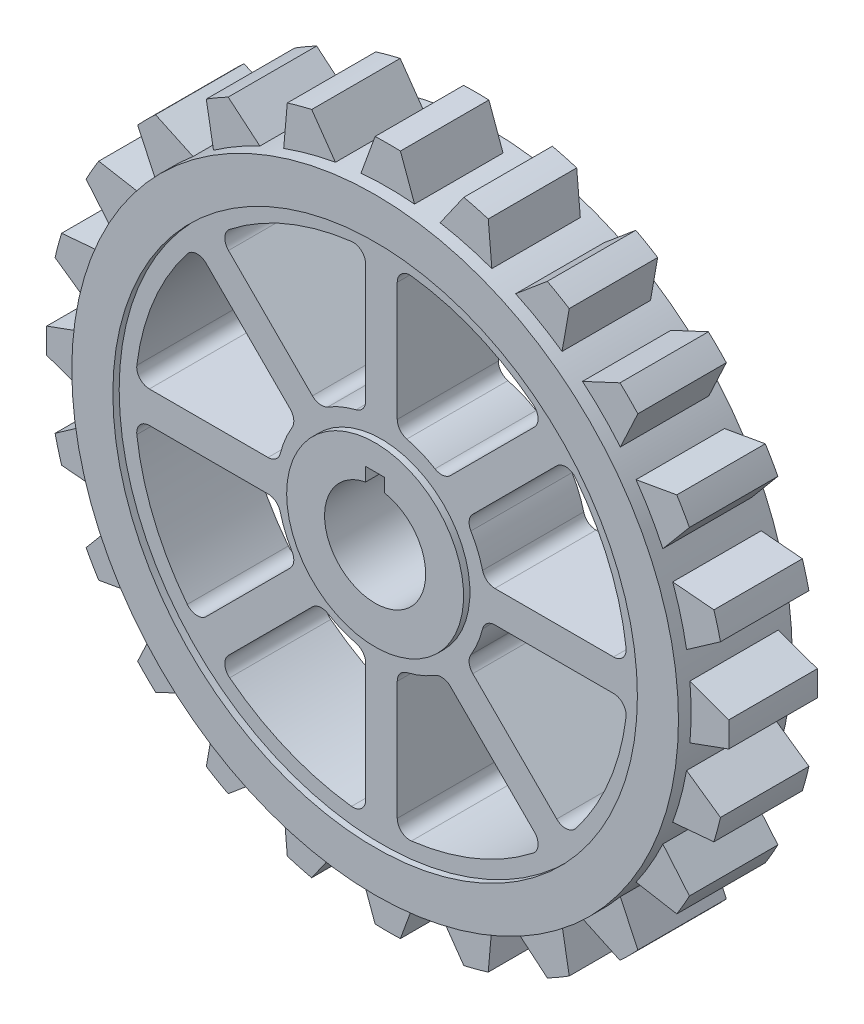
from build123d import *

# Parameters (mm, degrees)
BOSS_EXTRUDE1_DEPTH    = 14
BOSS_EXTRUDE1_2_DEPTH  = 14
BOSS_EXTRUDE1_3_DEPTH  = 14
BOSS_EXTRUDE1_4_DEPTH  = 14
BOSS_EXTRUDE1_5_DEPTH  = 14
BOSS_EXTRUDE1_6_DEPTH  = 14
BOSS_EXTRUDE1_7_DEPTH  = 14
BOSS_EXTRUDE1_8_DEPTH  = 14
BOSS_EXTRUDE1_9_DEPTH  = 14
BOSS_EXTRUDE1_10_DEPTH = 14
BOSS_EXTRUDE1_11_DEPTH = 14
BOSS_EXTRUDE1_12_DEPTH = 14
BOSS_EXTRUDE1_13_DEPTH = 14
BOSS_EXTRUDE1_14_DEPTH = 14
BOSS_EXTRUDE1_15_DEPTH = 14
BOSS_EXTRUDE1_16_DEPTH = 14
BOSS_EXTRUDE1_17_DEPTH = 14
BOSS_EXTRUDE1_18_DEPTH = 14
BOSS_EXTRUDE1_19_DEPTH = 14
BOSS_EXTRUDE1_20_DEPTH = 14
BOSS_EXTRUDE1_21_DEPTH = 14
BOSS_EXTRUDE1_22_DEPTH = 14
BOSS_EXTRUDE1_23_DEPTH = 14
BOSS_EXTRUDE1_24_DEPTH = 14
BOSS_EXTRUDE2_START    = -2
SKETCH2_R              = 48
SKETCH2_R_2            = 41.5
SKETCH2_R_3            = 14
BOSS_EXTRUDE2_DEPTH    = 18
BOSS_EXTRUDE3_START    = -1
BOSS_EXTRUDE3_DEPTH    = 16


with BuildPart() as part:
    # Sketch1 → Boss-Extrude1 (new body)
    with BuildSketch(Plane.XY):
        with BuildLine():
            Line((-4.238583665, 47.812492181), (-2, 53.962950253))
            ThreePointArc((-2, 53.962950253), (0, 54), (2, 53.962950253))
            Line((2, 53.962950253), (4.238583665, 47.812492181))
            ThreePointArc((4.238583665, 47.812492181), (0, 48), (-4.238583665, 47.812492181))
        make_face()
    extrude(amount=BOSS_EXTRUDE1_DEPTH)



with BuildPart() as body_2:
    # Sketch1 → Boss-Extrude1 2 (new body)
    with BuildSketch(Plane.XY):
        with BuildLine():
            Line((15.898490908, 51.606569222), (16.468940999, 45.08629484))
            ThreePointArc((16.468940999, 45.08629484), (12.423314165, 46.364439662), (8.280626141, 47.280347193))
            Line((8.280626141, 47.280347193), (12.034787603, 52.641845402))
            ThreePointArc((12.034787603, 52.641845402), (13.976228436, 52.15999462), (15.898490908, 51.606569222))
        make_face()
    extrude(amount=BOSS_EXTRUDE1_2_DEPTH)


with BuildPart() as body_3:
    # Sketch1 → Boss-Extrude1 3 (new body)
    with BuildSketch(Plane.XY):
        with BuildLine():
            Line((28.713525934, 45.733285782), (27.576967221, 39.287541014))
            ThreePointArc((27.576967221, 39.287541014), (24, 41.569219382), (20.23552496, 43.526124679))
            Line((20.23552496, 43.526124679), (25.249424319, 47.733285782))
            ThreePointArc((25.249424319, 47.733285782), (27, 46.765371804), (28.713525934, 45.733285782))
        make_face()
    extrude(amount=BOSS_EXTRUDE1_3_DEPTH)


with BuildPart() as body_4:
    # Sketch1 → Boss-Extrude1 4 (new body)
    with BuildSketch(Plane.XY):
        with BuildLine():
            Line((39.571781619, 36.743354494), (36.805668699, 30.811406194))
            ThreePointArc((36.805668699, 30.811406194), (33.941125497, 33.941125497), (30.811406194, 36.805668699))
            Line((30.811406194, 36.805668699), (36.743354494, 39.571781619))
            ThreePointArc((36.743354494, 39.571781619), (38.183766184, 38.183766184), (39.571781619, 36.743354494))
        make_face()
    extrude(amount=BOSS_EXTRUDE1_4_DEPTH)


with BuildPart() as body_5:
    # Sketch1 → Boss-Extrude1 5 (new body)
    with BuildSketch(Plane.XY):
        with BuildLine():
            Line((47.733285782, 25.249424319), (43.526124679, 20.23552496))
            ThreePointArc((43.526124679, 20.23552496), (41.569219382, 24), (39.287541014, 27.576967221))
            Line((39.287541014, 27.576967221), (45.733285782, 28.713525934))
            ThreePointArc((45.733285782, 28.713525934), (46.765371804, 27), (47.733285782, 25.249424319))
        make_face()
    extrude(amount=BOSS_EXTRUDE1_5_DEPTH)


with BuildPart() as body_6:
    # Sketch1 → Boss-Extrude1 6 (new body)
    with BuildSketch(Plane.XY):
        with BuildLine():
            Line((52.641845402, 12.034787603), (47.280347193, 8.280626141))
            ThreePointArc((47.280347193, 8.280626141), (46.364439662, 12.423314165), (45.08629484, 16.468940999))
            Line((45.08629484, 16.468940999), (51.606569222, 15.898490908))
            ThreePointArc((51.606569222, 15.898490908), (52.15999462, 13.976228436), (52.641845402, 12.034787603))
        make_face()
    extrude(amount=BOSS_EXTRUDE1_6_DEPTH)


with BuildPart() as body_7:
    # Sketch1 → Boss-Extrude1 7 (new body)
    with BuildSketch(Plane.XY):
        with BuildLine():
            Line((53.962950253, -2), (47.812492181, -4.238583665))
            ThreePointArc((47.812492181, -4.238583665), (48, 0), (47.812492181, 4.238583665))
            Line((47.812492181, 4.238583665), (53.962950253, 2))
            ThreePointArc((53.962950253, 2), (54, 0), (53.962950253, -2))
        make_face()
    extrude(amount=BOSS_EXTRUDE1_7_DEPTH)


with BuildPart() as body_8:
    # Sketch1 → Boss-Extrude1 8 (new body)
    with BuildSketch(Plane.XY):
        with BuildLine():
            Line((51.606569222, -15.898490908), (45.08629484, -16.468940999))
            ThreePointArc((45.08629484, -16.468940999), (46.364439662, -12.423314165), (47.280347193, -8.280626141))
            Line((47.280347193, -8.280626141), (52.641845402, -12.034787603))
            ThreePointArc((52.641845402, -12.034787603), (52.15999462, -13.976228436), (51.606569222, -15.898490908))
        make_face()
    extrude(amount=BOSS_EXTRUDE1_8_DEPTH)


with BuildPart() as body_9:
    # Sketch1 → Boss-Extrude1 9 (new body)
    with BuildSketch(Plane.XY):
        with BuildLine():
            Line((45.733285782, -28.713525934), (39.287541014, -27.576967221))
            ThreePointArc((39.287541014, -27.576967221), (41.569219382, -24), (43.526124679, -20.23552496))
            Line((43.526124679, -20.23552496), (47.733285782, -25.249424319))
            ThreePointArc((47.733285782, -25.249424319), (46.765371804, -27), (45.733285782, -28.713525934))
        make_face()
    extrude(amount=BOSS_EXTRUDE1_9_DEPTH)


with BuildPart() as body_10:
    # Sketch1 → Boss-Extrude1 10 (new body)
    with BuildSketch(Plane.XY):
        with BuildLine():
            Line((36.743354494, -39.571781619), (30.811406194, -36.805668699))
            ThreePointArc((30.811406194, -36.805668699), (33.941125497, -33.941125497), (36.805668699, -30.811406194))
            Line((36.805668699, -30.811406194), (39.571781619, -36.743354494))
            ThreePointArc((39.571781619, -36.743354494), (38.183766184, -38.183766184), (36.743354494, -39.571781619))
        make_face()
    extrude(amount=BOSS_EXTRUDE1_10_DEPTH)


with BuildPart() as body_11:
    # Sketch1 → Boss-Extrude1 11 (new body)
    with BuildSketch(Plane.XY):
        with BuildLine():
            Line((25.249424319, -47.733285782), (20.23552496, -43.526124679))
            ThreePointArc((20.23552496, -43.526124679), (24, -41.569219382), (27.576967221, -39.287541014))
            Line((27.576967221, -39.287541014), (28.713525934, -45.733285782))
            ThreePointArc((28.713525934, -45.733285782), (27, -46.765371804), (25.249424319, -47.733285782))
        make_face()
    extrude(amount=BOSS_EXTRUDE1_11_DEPTH)


with BuildPart() as body_12:
    # Sketch1 → Boss-Extrude1 12 (new body)
    with BuildSketch(Plane.XY):
        with BuildLine():
            Line((12.034787603, -52.641845402), (8.280626141, -47.280347193))
            ThreePointArc((8.280626141, -47.280347193), (12.423314165, -46.364439662), (16.468940999, -45.08629484))
            Line((16.468940999, -45.08629484), (15.898490908, -51.606569222))
            ThreePointArc((15.898490908, -51.606569222), (13.976228436, -52.15999462), (12.034787603, -52.641845402))
        make_face()
    extrude(amount=BOSS_EXTRUDE1_12_DEPTH)


with BuildPart() as body_13:
    # Sketch1 → Boss-Extrude1 13 (new body)
    with BuildSketch(Plane.XY):
        with BuildLine():
            Line((-2, -53.962950253), (-4.238583665, -47.812492181))
            ThreePointArc((-4.238583665, -47.812492181), (0, -48), (4.238583665, -47.812492181))
            Line((4.238583665, -47.812492181), (2, -53.962950253))
            ThreePointArc((2, -53.962950253), (0, -54), (-2, -53.962950253))
        make_face()
    extrude(amount=BOSS_EXTRUDE1_13_DEPTH)


with BuildPart() as body_14:
    # Sketch1 → Boss-Extrude1 14 (new body)
    with BuildSketch(Plane.XY):
        with BuildLine():
            Line((-15.898490908, -51.606569222), (-16.468940999, -45.08629484))
            ThreePointArc((-16.468940999, -45.08629484), (-12.423314165, -46.364439662), (-8.280626141, -47.280347193))
            Line((-8.280626141, -47.280347193), (-12.034787603, -52.641845402))
            ThreePointArc((-12.034787603, -52.641845402), (-13.976228436, -52.15999462), (-15.898490908, -51.606569222))
        make_face()
    extrude(amount=BOSS_EXTRUDE1_14_DEPTH)


with BuildPart() as body_15:
    # Sketch1 → Boss-Extrude1 15 (new body)
    with BuildSketch(Plane.XY):
        with BuildLine():
            Line((-28.713525934, -45.733285782), (-27.576967221, -39.287541014))
            ThreePointArc((-27.576967221, -39.287541014), (-24, -41.569219382), (-20.23552496, -43.526124679))
            Line((-20.23552496, -43.526124679), (-25.249424319, -47.733285782))
            ThreePointArc((-25.249424319, -47.733285782), (-27, -46.765371804), (-28.713525934, -45.733285782))
        make_face()
    extrude(amount=BOSS_EXTRUDE1_15_DEPTH)


with BuildPart() as body_16:
    # Sketch1 → Boss-Extrude1 16 (new body)
    with BuildSketch(Plane.XY):
        with BuildLine():
            Line((-39.571781619, -36.743354494), (-36.805668699, -30.811406194))
            ThreePointArc((-36.805668699, -30.811406194), (-33.941125497, -33.941125497), (-30.811406194, -36.805668699))
            Line((-30.811406194, -36.805668699), (-36.743354494, -39.571781619))
            ThreePointArc((-36.743354494, -39.571781619), (-38.183766184, -38.183766184), (-39.571781619, -36.743354494))
        make_face()
    extrude(amount=BOSS_EXTRUDE1_16_DEPTH)


with BuildPart() as body_17:
    # Sketch1 → Boss-Extrude1 17 (new body)
    with BuildSketch(Plane.XY):
        with BuildLine():
            Line((-47.733285782, -25.249424319), (-43.526124679, -20.23552496))
            ThreePointArc((-43.526124679, -20.23552496), (-41.569219382, -24), (-39.287541014, -27.576967221))
            Line((-39.287541014, -27.576967221), (-45.733285782, -28.713525934))
            ThreePointArc((-45.733285782, -28.713525934), (-46.765371804, -27), (-47.733285782, -25.249424319))
        make_face()
    extrude(amount=BOSS_EXTRUDE1_17_DEPTH)


with BuildPart() as body_18:
    # Sketch1 → Boss-Extrude1 18 (new body)
    with BuildSketch(Plane.XY):
        with BuildLine():
            Line((-52.641845402, -12.034787603), (-47.280347193, -8.280626141))
            ThreePointArc((-47.280347193, -8.280626141), (-46.364439662, -12.423314165), (-45.08629484, -16.468940999))
            Line((-45.08629484, -16.468940999), (-51.606569222, -15.898490908))
            ThreePointArc((-51.606569222, -15.898490908), (-52.15999462, -13.976228436), (-52.641845402, -12.034787603))
        make_face()
    extrude(amount=BOSS_EXTRUDE1_18_DEPTH)


with BuildPart() as body_19:
    # Sketch1 → Boss-Extrude1 19 (new body)
    with BuildSketch(Plane.XY):
        with BuildLine():
            Line((-53.962950253, 2), (-47.812492181, 4.238583665))
            ThreePointArc((-47.812492181, 4.238583665), (-48, 0), (-47.812492181, -4.238583665))
            Line((-47.812492181, -4.238583665), (-53.962950253, -2))
            ThreePointArc((-53.962950253, -2), (-54, 0), (-53.962950253, 2))
        make_face()
    extrude(amount=BOSS_EXTRUDE1_19_DEPTH)


with BuildPart() as body_20:
    # Sketch1 → Boss-Extrude1 20 (new body)
    with BuildSketch(Plane.XY):
        with BuildLine():
            Line((-51.606569222, 15.898490908), (-45.08629484, 16.468940999))
            ThreePointArc((-45.08629484, 16.468940999), (-46.364439662, 12.423314165), (-47.280347193, 8.280626141))
            Line((-47.280347193, 8.280626141), (-52.641845402, 12.034787603))
            ThreePointArc((-52.641845402, 12.034787603), (-52.15999462, 13.976228436), (-51.606569222, 15.898490908))
        make_face()
    extrude(amount=BOSS_EXTRUDE1_20_DEPTH)


with BuildPart() as body_21:
    # Sketch1 → Boss-Extrude1 21 (new body)
    with BuildSketch(Plane.XY):
        with BuildLine():
            Line((-45.733285782, 28.713525934), (-39.287541014, 27.576967221))
            ThreePointArc((-39.287541014, 27.576967221), (-41.569219382, 24), (-43.526124679, 20.23552496))
            Line((-43.526124679, 20.23552496), (-47.733285782, 25.249424319))
            ThreePointArc((-47.733285782, 25.249424319), (-46.765371804, 27), (-45.733285782, 28.713525934))
        make_face()
    extrude(amount=BOSS_EXTRUDE1_21_DEPTH)


with BuildPart() as body_22:
    # Sketch1 → Boss-Extrude1 22 (new body)
    with BuildSketch(Plane.XY):
        with BuildLine():
            Line((-36.743354494, 39.571781619), (-30.811406194, 36.805668699))
            ThreePointArc((-30.811406194, 36.805668699), (-33.941125497, 33.941125497), (-36.805668699, 30.811406194))
            Line((-36.805668699, 30.811406194), (-39.571781619, 36.743354494))
            ThreePointArc((-39.571781619, 36.743354494), (-38.183766184, 38.183766184), (-36.743354494, 39.571781619))
        make_face()
    extrude(amount=BOSS_EXTRUDE1_22_DEPTH)


with BuildPart() as body_23:
    # Sketch1 → Boss-Extrude1 23 (new body)
    with BuildSketch(Plane.XY):
        with BuildLine():
            Line((-25.249424319, 47.733285782), (-20.23552496, 43.526124679))
            ThreePointArc((-20.23552496, 43.526124679), (-24, 41.569219382), (-27.576967221, 39.287541014))
            Line((-27.576967221, 39.287541014), (-28.713525934, 45.733285782))
            ThreePointArc((-28.713525934, 45.733285782), (-27, 46.765371804), (-25.249424319, 47.733285782))
        make_face()
    extrude(amount=BOSS_EXTRUDE1_23_DEPTH)


with BuildPart() as body_24:
    # Sketch1 → Boss-Extrude1 24 (new body)
    with BuildSketch(Plane.XY):
        with BuildLine():
            Line((-12.034787603, 52.641845402), (-8.280626141, 47.280347193))
            ThreePointArc((-8.280626141, 47.280347193), (-12.423314165, 46.364439662), (-16.468940999, 45.08629484))
            Line((-16.468940999, 45.08629484), (-15.898490908, 51.606569222))
            ThreePointArc((-15.898490908, 51.606569222), (-13.976228436, 52.15999462), (-12.034787603, 52.641845402))
        make_face()
    extrude(amount=BOSS_EXTRUDE1_24_DEPTH)


with BuildPart() as part_1:
    add(part.part)

    add(body_2.part)  # Boss-Extrude2 merges body 2

    add(body_3.part)  # Boss-Extrude2 merges body 3

    add(body_4.part)  # Boss-Extrude2 merges body 4

    add(body_5.part)  # Boss-Extrude2 merges body 5

    add(body_6.part)  # Boss-Extrude2 merges body 6

    add(body_7.part)  # Boss-Extrude2 merges body 7

    add(body_8.part)  # Boss-Extrude2 merges body 8

    add(body_9.part)  # Boss-Extrude2 merges body 9

    add(body_10.part)  # Boss-Extrude2 merges body 10

    add(body_11.part)  # Boss-Extrude2 merges body 11

    add(body_12.part)  # Boss-Extrude2 merges body 12

    add(body_13.part)  # Boss-Extrude2 merges body 13

    add(body_14.part)  # Boss-Extrude2 merges body 14

    add(body_15.part)  # Boss-Extrude2 merges body 15

    add(body_16.part)  # Boss-Extrude2 merges body 16

    add(body_17.part)  # Boss-Extrude2 merges body 17

    add(body_18.part)  # Boss-Extrude2 merges body 18

    add(body_19.part)  # Boss-Extrude2 merges body 19

    add(body_20.part)  # Boss-Extrude2 merges body 20

    add(body_21.part)  # Boss-Extrude2 merges body 21

    add(body_22.part)  # Boss-Extrude2 merges body 22

    add(body_23.part)  # Boss-Extrude2 merges body 23

    add(body_24.part)  # Boss-Extrude2 merges body 24
    # Sketch2 → Boss-Extrude2 (add)
    # profile 1 of 2: a face of its own
    with BuildSketch(Plane.XY.offset(BOSS_EXTRUDE2_START)):
        with Locations(Location((0, 0, 0), (0, 0, 180))):
            Circle(SKETCH2_R)
        with Locations(Location((0, 0, 0), (0, 0, 180))):
            Circle(SKETCH2_R_2, mode=Mode.SUBTRACT)
    # profile 2 of 2: a face of its own
    with BuildSketch(Plane.XY.offset(BOSS_EXTRUDE2_START)):
        with Locations(Location((0, 0, 0), (0, 0, 180))):
            Circle(SKETCH2_R_3)
        with BuildLine():
            Line((-1.5, 7.858116823), (-1.5, 10))
            Line((-1.5, 10), (1.5, 10))
            Line((1.5, 10), (1.5, 7.858116823))
            ThreePointArc((1.5, 7.858116823), (0, -8), (-1.5, 7.858116823))
        make_face(mode=Mode.SUBTRACT)
    extrude(amount=BOSS_EXTRUDE2_DEPTH)

    # Sketch3 → Boss-Extrude3 (add)
    # profile 1 of 8: a face of its own
    with BuildSketch(Plane.XY.offset(BOSS_EXTRUDE3_START)):
        with BuildLine():
            ThreePointArc((9.899494937, 9.899494937), (5.357568053, 12.934313455), (0, 14))
            Line((0, 14), (0, 41.5))
            ThreePointArc((0, 41.5), (15.881362443, 38.341000599), (29.344931419, 29.344931419))
            Line((29.344931419, 29.344931419), (9.899494937, 9.899494937))
        make_face()
        with BuildLine():
            ThreePointArc((8.478856806, 14.15482205), (6.314276634, 15.244012286), (4.013513514, 16.004427802))
            ThreePointArc((4.013513514, 16.004427802), (2.923140309, 16.714109074), (2.5, 17.944358445))
            Line((2.5, 17.944358445), (2.5, 36.725331857))
            ThreePointArc((2.5, 36.725331857), (3.174572991, 38.223077911), (4.743243243, 38.71048493))
            ThreePointArc((4.743243243, 38.71048493), (14.924653862, 36.031301768), (24.018466935, 30.726425859))
            ThreePointArc((24.018466935, 30.726425859), (24.7830355, 29.272559678), (24.200964244, 27.73649815))
            Line((24.200964244, 27.73649815), (10.920810587, 14.456344493))
            ThreePointArc((10.920810587, 14.456344493), (9.751687534, 13.885632203), (8.478856806, 14.15482205))
        make_face(mode=Mode.SUBTRACT)
    # profile 2 of 8: a face of its own
    with BuildSketch(Plane.XY.offset(BOSS_EXTRUDE3_START)):
        with BuildLine():
            ThreePointArc((-41.5, 0), (-38.341000599, 15.881362443), (-29.344931419, 29.344931419))
            Line((-29.344931419, 29.344931419), (-9.899494937, 9.899494937))
            ThreePointArc((-9.899494937, 9.899494937), (-12.934313455, 5.357568053), (-14, 0))
            Line((-14, 0), (-41.5, 0))
        make_face()
        with BuildLine():
            ThreePointArc((-14.456344493, 10.920810587), (-13.885632203, 9.751687534), (-14.15482205, 8.478856806))
            ThreePointArc((-14.15482205, 8.478856806), (-15.244012286, 6.314276634), (-16.004427802, 4.013513514))
            ThreePointArc((-16.004427802, 4.013513514), (-16.714109074, 2.923140309), (-17.944358445, 2.5))
            Line((-17.944358445, 2.5), (-36.725331857, 2.5))
            ThreePointArc((-36.725331857, 2.5), (-38.223077911, 3.174572991), (-38.71048493, 4.743243243))
            ThreePointArc((-38.71048493, 4.743243243), (-36.031301768, 14.924653862), (-30.726425859, 24.018466935))
            ThreePointArc((-30.726425859, 24.018466935), (-29.272559678, 24.7830355), (-27.73649815, 24.200964244))
            Line((-27.73649815, 24.200964244), (-14.456344493, 10.920810587))
        make_face(mode=Mode.SUBTRACT)
    # profile 3 of 8: a face of its own
    with BuildSketch(Plane.XY.offset(BOSS_EXTRUDE3_START)):
        with BuildLine():
            ThreePointArc((-29.344931419, 29.344931419), (-15.881362443, 38.341000599), (0, 41.5))
            Line((0, 41.5), (0, 14))
            ThreePointArc((0, 14), (-5.357568053, 12.934313455), (-9.899494937, 9.899494937))
            Line((-9.899494937, 9.899494937), (-29.344931419, 29.344931419))
        make_face()
        with BuildLine():
            ThreePointArc((-2.5, 17.944358445), (-2.923140309, 16.714109074), (-4.013513514, 16.004427802))
            ThreePointArc((-4.013513514, 16.004427802), (-6.314276634, 15.244012286), (-8.478856806, 14.15482205))
            ThreePointArc((-8.478856806, 14.15482205), (-9.751687534, 13.885632203), (-10.920810587, 14.456344493))
            Line((-10.920810587, 14.456344493), (-24.200964244, 27.73649815))
            ThreePointArc((-24.200964244, 27.73649815), (-24.7830355, 29.272559678), (-24.018466935, 30.726425859))
            ThreePointArc((-24.018466935, 30.726425859), (-14.924653862, 36.031301768), (-4.743243243, 38.71048493))
            ThreePointArc((-4.743243243, 38.71048493), (-3.174572991, 38.223077911), (-2.5, 36.725331857))
            Line((-2.5, 36.725331857), (-2.5, 17.944358445))
        make_face(mode=Mode.SUBTRACT)
    # profile 4 of 8: a face of its own
    with BuildSketch(Plane.XY.offset(BOSS_EXTRUDE3_START)):
        with BuildLine():
            ThreePointArc((-29.344931419, -29.344931419), (-38.341000599, -15.881362443), (-41.5, 0))
            Line((-41.5, 0), (-14, 0))
            ThreePointArc((-14, 0), (-12.934313455, -5.357568053), (-9.899494937, -9.899494937))
            Line((-9.899494937, -9.899494937), (-29.344931419, -29.344931419))
        make_face()
        with BuildLine():
            ThreePointArc((-17.944358445, -2.5), (-16.714109074, -2.923140309), (-16.004427802, -4.013513514))
            ThreePointArc((-16.004427802, -4.013513514), (-15.244012286, -6.314276634), (-14.15482205, -8.478856806))
            ThreePointArc((-14.15482205, -8.478856806), (-13.885632203, -9.751687534), (-14.456344493, -10.920810587))
            Line((-14.456344493, -10.920810587), (-27.73649815, -24.200964244))
            ThreePointArc((-27.73649815, -24.200964244), (-29.272559678, -24.7830355), (-30.726425859, -24.018466935))
            ThreePointArc((-30.726425859, -24.018466935), (-36.031301768, -14.924653862), (-38.71048493, -4.743243243))
            ThreePointArc((-38.71048493, -4.743243243), (-38.223077911, -3.174572991), (-36.725331857, -2.5))
            Line((-36.725331857, -2.5), (-17.944358445, -2.5))
        make_face(mode=Mode.SUBTRACT)
    # profile 5 of 8: a face of its own
    with BuildSketch(Plane.XY.offset(BOSS_EXTRUDE3_START)):
        with BuildLine():
            ThreePointArc((0, -41.5), (-15.881362443, -38.341000599), (-29.344931419, -29.344931419))
            Line((-29.344931419, -29.344931419), (-9.899494937, -9.899494937))
            ThreePointArc((-9.899494937, -9.899494937), (-5.357568053, -12.934313455), (0, -14))
            Line((0, -14), (0, -41.5))
        make_face()
        with BuildLine():
            ThreePointArc((-10.920810587, -14.456344493), (-9.751687534, -13.885632203), (-8.478856806, -14.15482205))
            ThreePointArc((-8.478856806, -14.15482205), (-6.314276634, -15.244012286), (-4.013513514, -16.004427802))
            ThreePointArc((-4.013513514, -16.004427802), (-2.923140309, -16.714109074), (-2.5, -17.944358445))
            Line((-2.5, -17.944358445), (-2.5, -36.725331857))
            ThreePointArc((-2.5, -36.725331857), (-3.174572991, -38.223077911), (-4.743243243, -38.71048493))
            ThreePointArc((-4.743243243, -38.71048493), (-14.924653862, -36.031301768), (-24.018466935, -30.726425859))
            ThreePointArc((-24.018466935, -30.726425859), (-24.7830355, -29.272559678), (-24.200964244, -27.73649815))
            Line((-24.200964244, -27.73649815), (-10.920810587, -14.456344493))
        make_face(mode=Mode.SUBTRACT)
    # profile 6 of 8: a face of its own
    with BuildSketch(Plane.XY.offset(BOSS_EXTRUDE3_START)):
        with BuildLine():
            ThreePointArc((29.344931419, -29.344931419), (15.881362443, -38.341000599), (0, -41.5))
            Line((0, -41.5), (0, -14))
            ThreePointArc((0, -14), (5.357568053, -12.934313455), (9.899494937, -9.899494937))
            Line((9.899494937, -9.899494937), (29.344931419, -29.344931419))
        make_face()
        with BuildLine():
            ThreePointArc((2.5, -17.944358445), (2.923140309, -16.714109074), (4.013513514, -16.004427802))
            ThreePointArc((4.013513514, -16.004427802), (6.314276634, -15.244012286), (8.478856806, -14.15482205))
            ThreePointArc((8.478856806, -14.15482205), (9.751687534, -13.885632203), (10.920810587, -14.456344493))
            Line((10.920810587, -14.456344493), (24.200964244, -27.73649815))
            ThreePointArc((24.200964244, -27.73649815), (24.7830355, -29.272559678), (24.018466935, -30.726425859))
            ThreePointArc((24.018466935, -30.726425859), (14.924653862, -36.031301768), (4.743243243, -38.71048493))
            ThreePointArc((4.743243243, -38.71048493), (3.174572991, -38.223077911), (2.5, -36.725331857))
            Line((2.5, -36.725331857), (2.5, -17.944358445))
        make_face(mode=Mode.SUBTRACT)
    # profile 7 of 8: a face of its own
    with BuildSketch(Plane.XY.offset(BOSS_EXTRUDE3_START)):
        with BuildLine():
            ThreePointArc((41.5, 0), (38.341000599, -15.881362443), (29.344931419, -29.344931419))
            Line((29.344931419, -29.344931419), (9.899494937, -9.899494937))
            ThreePointArc((9.899494937, -9.899494937), (12.934313455, -5.357568053), (14, 0))
            Line((14, 0), (41.5, 0))
        make_face()
        with BuildLine():
            ThreePointArc((14.456344493, -10.920810587), (13.885632203, -9.751687534), (14.15482205, -8.478856806))
            ThreePointArc((14.15482205, -8.478856806), (15.244012286, -6.314276634), (16.004427802, -4.013513514))
            ThreePointArc((16.004427802, -4.013513514), (16.714109074, -2.923140309), (17.944358445, -2.5))
            Line((17.944358445, -2.5), (36.725331857, -2.5))
            ThreePointArc((36.725331857, -2.5), (38.223077911, -3.174572991), (38.71048493, -4.743243243))
            ThreePointArc((38.71048493, -4.743243243), (36.031301768, -14.924653862), (30.726425859, -24.018466935))
            ThreePointArc((30.726425859, -24.018466935), (29.272559678, -24.7830355), (27.73649815, -24.200964244))
            Line((27.73649815, -24.200964244), (14.456344493, -10.920810587))
        make_face(mode=Mode.SUBTRACT)
    # profile 8 of 8: a face of its own
    with BuildSketch(Plane.XY.offset(BOSS_EXTRUDE3_START)):
        with BuildLine():
            ThreePointArc((29.344931419, 29.344931419), (38.341000599, 15.881362443), (41.5, 0))
            Line((41.5, 0), (14, 0))
            ThreePointArc((14, 0), (12.934313455, 5.357568053), (9.899494937, 9.899494937))
            Line((9.899494937, 9.899494937), (29.344931419, 29.344931419))
        make_face()
        with BuildLine():
            ThreePointArc((17.944358445, 2.5), (16.714109074, 2.923140309), (16.004427802, 4.013513514))
            ThreePointArc((16.004427802, 4.013513514), (15.244012286, 6.314276634), (14.15482205, 8.478856806))
            ThreePointArc((14.15482205, 8.478856806), (13.885632203, 9.751687534), (14.456344493, 10.920810587))
            Line((14.456344493, 10.920810587), (27.73649815, 24.200964244))
            ThreePointArc((27.73649815, 24.200964244), (29.272559678, 24.7830355), (30.726425859, 24.018466935))
            ThreePointArc((30.726425859, 24.018466935), (36.031301768, 14.924653862), (38.71048493, 4.743243243))
            ThreePointArc((38.71048493, 4.743243243), (38.223077911, 3.174572991), (36.725331857, 2.5))
            Line((36.725331857, 2.5), (17.944358445, 2.5))
        make_face(mode=Mode.SUBTRACT)
    extrude(amount=BOSS_EXTRUDE3_DEPTH)


solid = part_1.part
